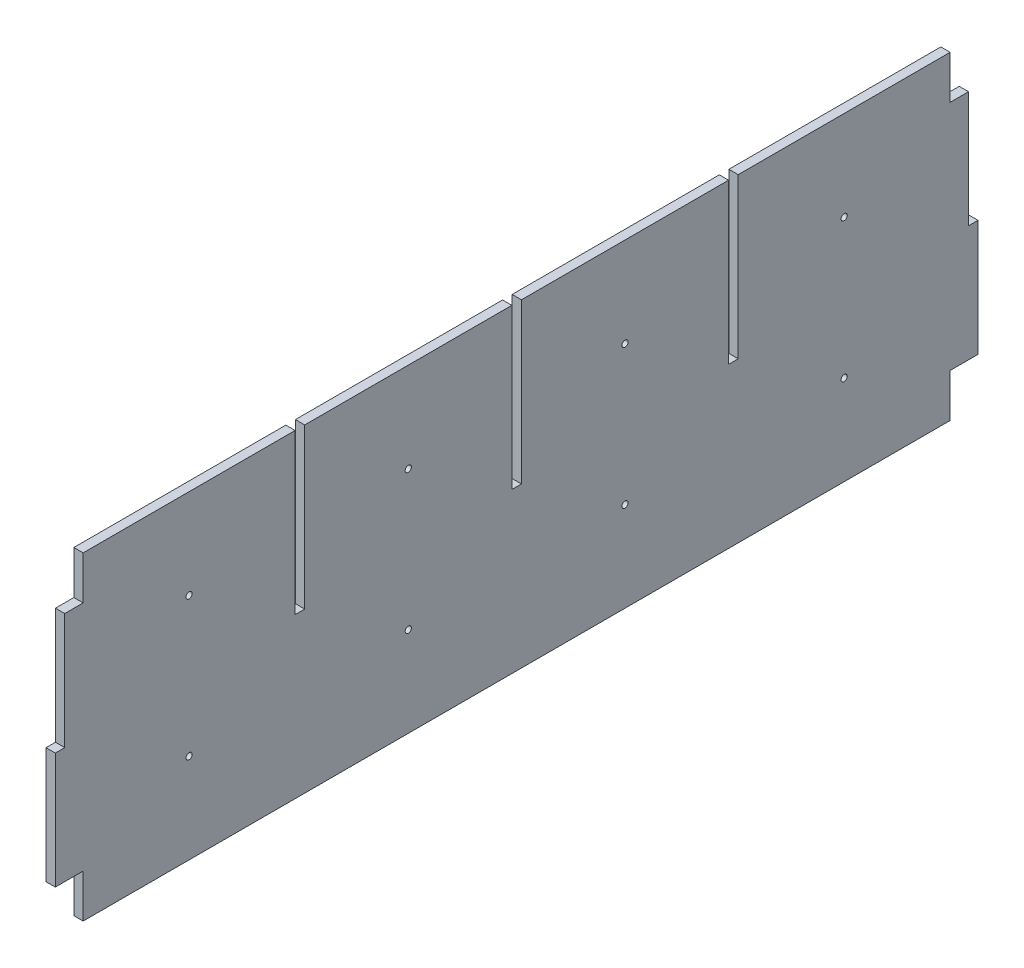
from build123d import *

# Parameters (mm, degrees)
BOSS_EXTRUDE1_DEPTH = 6
SKETCH2_W           = 6.2
SKETCH2_H           = 85
CUT_EXTRUDE1_DEPTH  = 6
SKETCH3_R           = 2
CUT_EXTRUDE2_DEPTH  = 6
SKETCH4_W           = 6
SKETCH4_H           = 136.9
SKETCH4_H_2         = 133.8
SKETCH4_H_3         = 137.464807664
BOSS_EXTRUDE2_DEPTH = 28
SKETCH5_W           = 6
SKETCH5_H           = 560
BOSS_EXTRUDE3_DEPTH = 28
SKETCH6_W           = 6
SKETCH6_H           = 0.564807664
CUT_EXTRUDE3_DEPTH  = 28
SKETCH7_W           = 6
SKETCH7_H           = 10
CUT_EXTRUDE4_DEPTH  = 1000


with BuildPart() as part:
    # Sketch1 → Boss-Extrude1 (new body)
    with BuildSketch(Plane(origin=(0, 0, 0), x_dir=(0, 0, -1), z_dir=(1, 0, 0))):
        Polygon((0, 0), (560, 0), (560, 10), (578, 10), (578, 85), (571.9, 85), (571.9, 160), (560, 160), (560, 170), (0, 170), (0, 160), (-11.9, 160), (-11.9, 85), (-18, 85), (-18, 10), (0, 10), align=None)
    extrude(amount=BOSS_EXTRUDE1_DEPTH)

    # Sketch2 → Cut-Extrude1 (cut)
    with BuildSketch(Plane(origin=(6, 0, 0), x_dir=(0, 0, -1), z_dir=(1, 0, 0))):
        with Locations((140, 127.5)):
            Rectangle(SKETCH2_W, SKETCH2_H)
        with Locations((280, 127.5)):
            Rectangle(SKETCH2_W, SKETCH2_H)
        with Locations((420, 127.5)):
            Rectangle(SKETCH2_W, SKETCH2_H)
    extrude(amount=-CUT_EXTRUDE1_DEPTH, mode=Mode.SUBTRACT)

    # Sketch3 → Cut-Extrude2 (cut)
    with BuildSketch(Plane(origin=(6, 0, 0), x_dir=(0, 0, -1), z_dir=(1, 0, 0))):
        with Locations((68.45, 130)):
            Circle(SKETCH3_R)
        with Locations((68.45, 40)):
            Circle(SKETCH3_R)
        with Locations((210, 130)):
            Circle(SKETCH3_R)
        with Locations((210, 40)):
            Circle(SKETCH3_R)
        with Locations((350, 130)):
            Circle(SKETCH3_R)
        with Locations((350, 40)):
            Circle(SKETCH3_R)
        with Locations((491.55, 130)):
            Circle(SKETCH3_R)
        with Locations((491.55, 40)):
            Circle(SKETCH3_R)
    extrude(amount=-CUT_EXTRUDE2_DEPTH, mode=Mode.SUBTRACT)

    # Sketch4 → Boss-Extrude2 (add)
    with BuildSketch(Plane(origin=(0, 170, 0), x_dir=(1, 0, 0), z_dir=(0, 1, 0))):
        with Locations((3, 68.45)):
            Rectangle(SKETCH4_W, SKETCH4_H)
        with Locations((3, 210)):
            Rectangle(SKETCH4_W, SKETCH4_H_2)
        with Locations((3, 350)):
            Rectangle(SKETCH4_W, SKETCH4_H_2)
        with Locations((3, 491.267596168)):
            Rectangle(SKETCH4_W, SKETCH4_H_3)
    extrude(amount=BOSS_EXTRUDE2_DEPTH)

    # Sketch5 → Boss-Extrude3 (add)
    with BuildSketch(Plane.XZ):
        with Locations((3, -280)):
            Rectangle(SKETCH5_W, SKETCH5_H)
    extrude(amount=BOSS_EXTRUDE3_DEPTH)

    # Sketch6 → Cut-Extrude3 (cut)
    with BuildSketch(Plane.XZ.offset(-170)):
        with Locations((3, -422.817596168)):
            Rectangle(SKETCH6_W, SKETCH6_H)
    extrude(amount=-CUT_EXTRUDE3_DEPTH, mode=Mode.SUBTRACT)

    # Sketch7 → Cut-Extrude4 (cut)
    with BuildSketch(Plane(origin=(0, 0, -560), x_dir=(-1, 0, 0), z_dir=(0, 0, -1))):
        with Locations((-3, 193)):
            Rectangle(SKETCH7_W, SKETCH7_H)
        with Locations((-3, -23)):
            Rectangle(SKETCH7_W, SKETCH7_H)
    extrude(amount=-CUT_EXTRUDE4_DEPTH, mode=Mode.SUBTRACT)


solid = part.part
